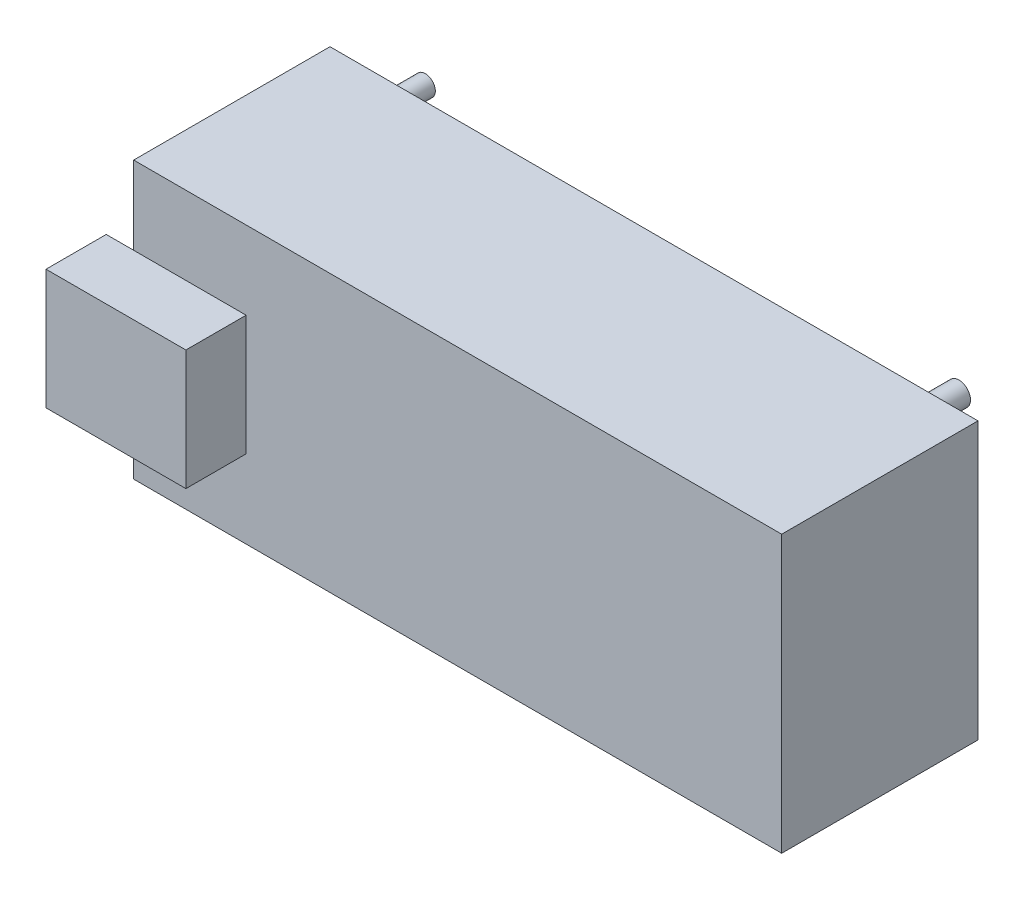
from build123d import *

# Parameters (mm, degrees)
SKETCH1_W      = 43.18
SKETCH1_H      = 18.415
EXTRUDE1_DEPTH = 13.081
SKETCH2_R      = 0.769945783
SKETCH2_R_2    = 0.721607375
SKETCH2_R_3    = 0.762102327
SKETCH2_R_4    = 0.671282844
EXTRUDE2_DEPTH = 2.54
SKETCH4_W      = 9.3218
SKETCH4_H      = 8.001
EXTRUDE3_DEPTH = 4.0132


with BuildPart() as part:
    # Sketch1 → Extrude1 (new body)
    with BuildSketch(Plane.XY):
        Rectangle(SKETCH1_W, SKETCH1_H)
    extrude(amount=EXTRUDE1_DEPTH)

    # Sketch2 → Extrude2 (add)
    with BuildSketch(Plane(origin=(0, 0, 0), x_dir=(-1, 0, 0), z_dir=(0, 0, -1))):
        with Locations((-17.78, 7.62)):
            Circle(SKETCH2_R)
        with Locations((-17.78, -7.62)):
            Circle(SKETCH2_R_2)
        with Locations((17.78, -7.62)):
            Circle(SKETCH2_R_3)
        with Locations((17.78, 7.62)):
            Circle(SKETCH2_R_4)
    extrude(amount=EXTRUDE2_DEPTH)

    # Sketch4 → Extrude3 (add)
    with BuildSketch(Plane.XY.offset(13.081)):
        with Locations((-18.7579, 0)):
            Rectangle(SKETCH4_W, SKETCH4_H)
    extrude(amount=EXTRUDE3_DEPTH)


solid = part.part
